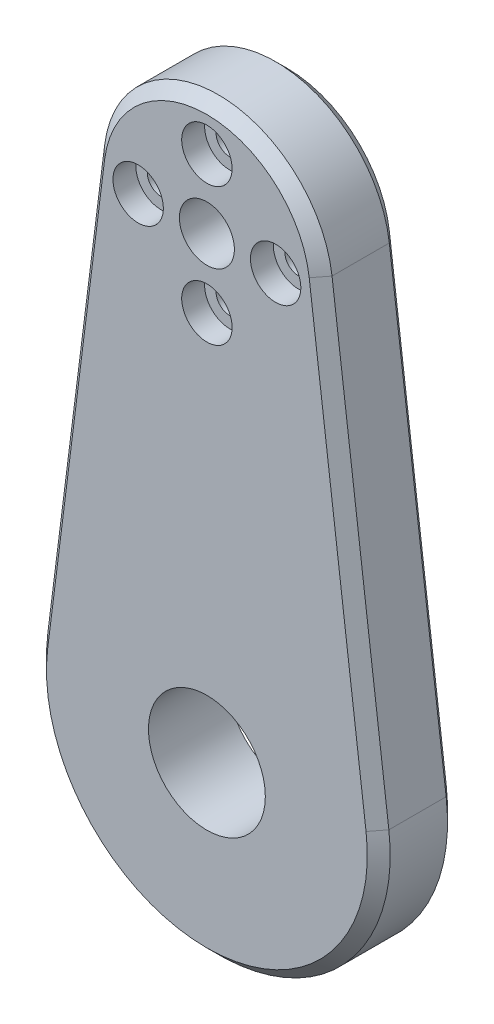
from build123d import *

# Parameters (mm, degrees)
SKETCH1_R                      = 2.4
SKETCH1_R_2                    = 5.1
BOSS_EXTRUDE1_DEPTH            = 7
CBORE_FOR_M2_SHCS1_D           = 2.4
CBORE_FOR_M2_SHCS1_CBORE_D     = 4.4
CBORE_FOR_M2_SHCS1_CBORE_DEPTH = 2
CHAMFER1_SIZE                  = 1


with BuildPart() as part:
    # Sketch1 → Boss-Extrude1 (new body)
    with BuildSketch(Plane.XY):
        with BuildLine():
            Line((-14.882351125, -38.125), (-9.921567416, 1.25))
            ThreePointArc((-9.921567416, 1.25), (0, 10), (9.921567416, 1.25))
            Line((9.921567416, 1.25), (14.882351125, -38.125))
            ThreePointArc((14.882351125, -38.125), (0, -55), (-14.882351125, -38.125))
        make_face()
        Circle(SKETCH1_R, mode=Mode.SUBTRACT)
        with Locations((0, -40)):
            Circle(SKETCH1_R_2, mode=Mode.SUBTRACT)
    extrude(amount=BOSS_EXTRUDE1_DEPTH)

    # CBORE for M2 SHCS1 (through all)
    with Locations(Plane.XY.offset(7)):
        with Locations((0, 6), (6, 0), (0, -6), (-6, 0)):
            CounterBoreHole(CBORE_FOR_M2_SHCS1_D / 2, CBORE_FOR_M2_SHCS1_CBORE_D / 2, CBORE_FOR_M2_SHCS1_CBORE_DEPTH)

    # Chamfer1
    chamfer1_edges = [part.edges().sort_by_distance(p)[0] for p in [
        (0, 10, 7),
        (-12.401959271, -18.4375, 7),
        (0, -55, 7),
        (-12.401959271, -18.4375, 0),
        (0, 10, 0),
        (12.401959271, -18.4375, 0),
        (0, -55, 0),
        (12.401959271, -18.4375, 7),
    ]]
    chamfer(chamfer1_edges, length=CHAMFER1_SIZE)


solid = part.part
